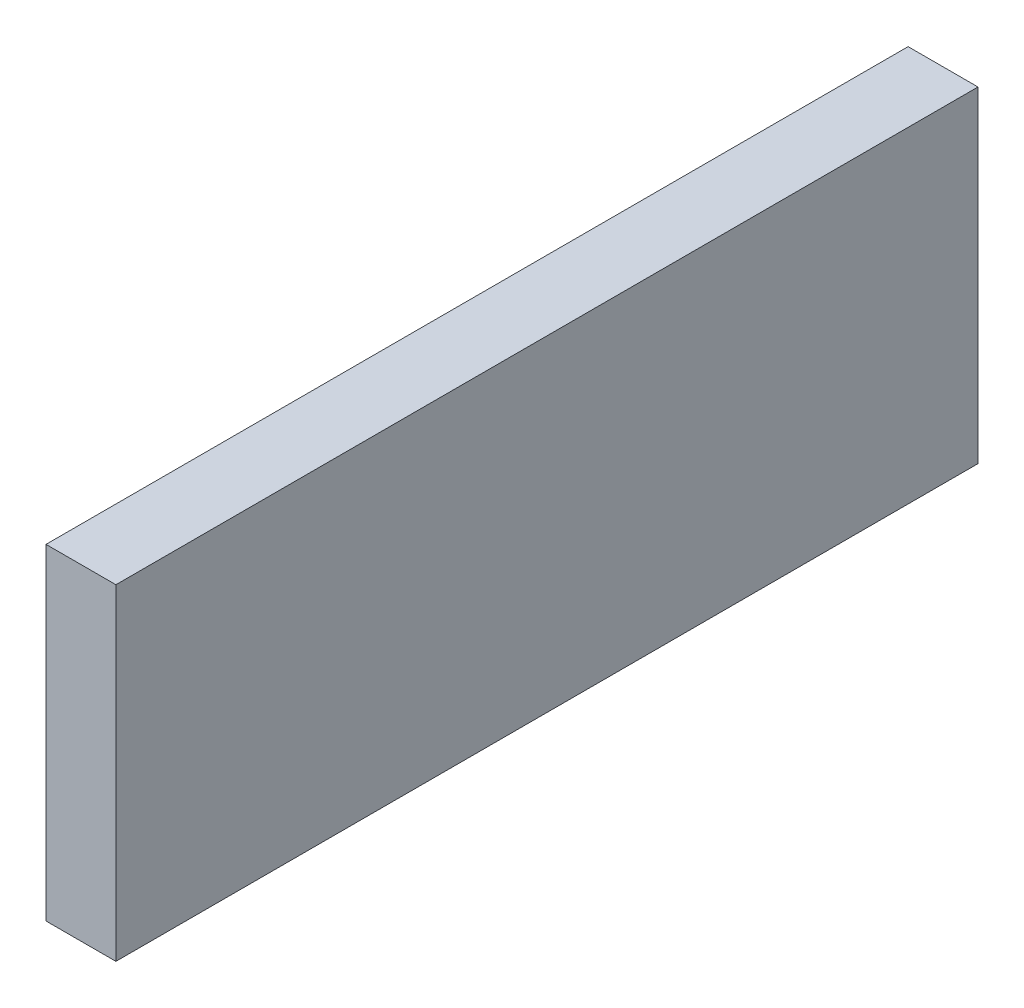
from build123d import *

# Parameters (mm, degrees)
SKETCH1_W           = 3
SKETCH1_H           = 37
BOSS_EXTRUDE1_DEPTH = 14


with BuildPart() as part:
    # Sketch1 → Boss-Extrude1 (new body)
    with BuildSketch(Plane(origin=(0, 0, 0), x_dir=(1, 0, 0), z_dir=(0, 1, 0))):
        with Locations((1.5, 18.5)):
            Rectangle(SKETCH1_W, SKETCH1_H)
    extrude(amount=BOSS_EXTRUDE1_DEPTH)


solid = part.part
